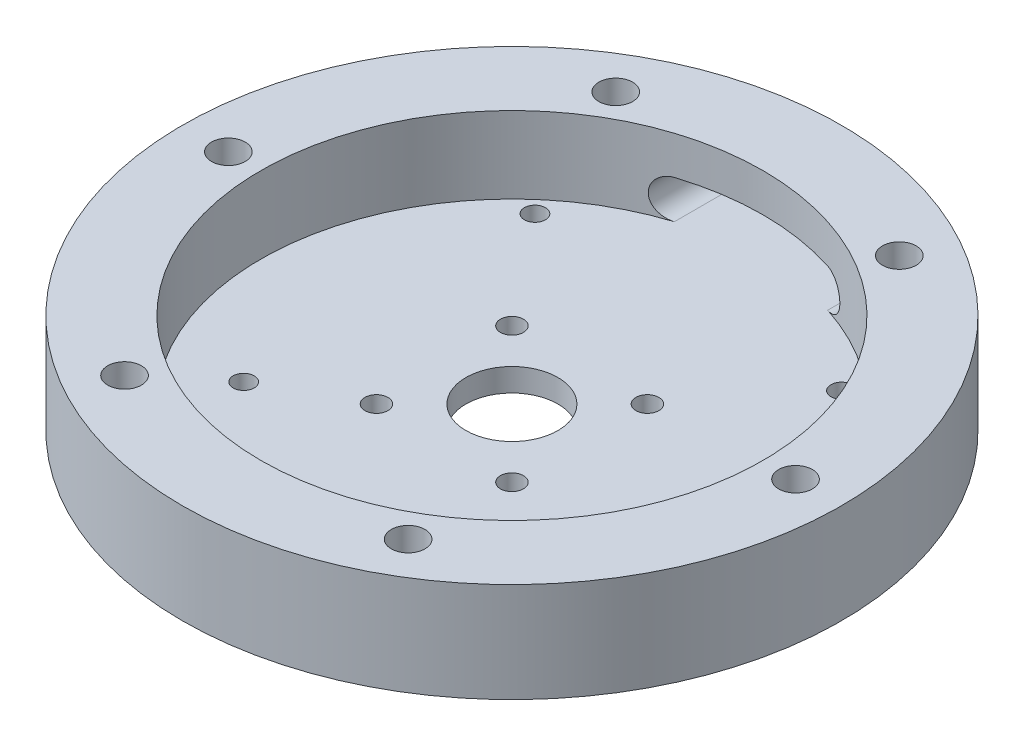
from build123d import *

# Parameters (mm, degrees)
SKETCH_1_R          = 43
SKETCH_1_R_2        = 6
EXTRUDE_1_DEPTH     = 3
SKETCH_14_R         = 43
SKETCH_14_R_2       = 32.76
EXTRUDE_5_DEPTH     = 10
SKETCH_17_R         = 2.35
EXTRUDE_6_DEPTH     = 6.4
SKETCH_18_R         = 1.375
CUT_EXTRUDE_5_DEPTH = 64.83071361
SKETCH_23_R         = 2.2
CUT_EXTRUDE_6_DEPTH = 6.1
CUT_EXTRUDE1_DEPTH  = 20
SKETCH_26_R         = 1.5
CUT_EXTRUDE3_DEPTH  = 6.1
CIRPATTERN1_COUNT   = 4
CIRPATTERN2_COUNT   = 6


with BuildPart() as part:
    # 스케치1 → 보스-돌출1 (new body)
    with BuildSketch(Plane(origin=(0, 0, 0), x_dir=(1, 0, 0), z_dir=(0, 1, 0))):
        with Locations(Location((0, 0, 0), (0, 0, 270))):
            Circle(SKETCH_1_R)
        with Locations(Location((0, 0, 0), (0, 0, 270))):
            Circle(SKETCH_1_R_2, mode=Mode.SUBTRACT)
    extrude(amount=EXTRUDE_1_DEPTH)

    # 스케치14 → 보스-돌출5 (add)
    with BuildSketch(Plane(origin=(0, 3, 0), x_dir=(1, 0, 0), z_dir=(0, 1, 0))):
        with Locations(Location((0, 0, 0), (0, 0, 270))):
            Circle(SKETCH_14_R)
        with Locations(Location((0, 0, 0), (0, 0, 270))):
            Circle(SKETCH_14_R_2, mode=Mode.SUBTRACT)
    extrude(amount=EXTRUDE_5_DEPTH)

    # 스케치17 → 보스-돌출6 (add)
    with BuildSketch(Plane.XZ):
        with Locations(Location((20, 15, 0), (0, 0, 90))):
            Circle(SKETCH_17_R)
        with Locations(Location((-20, 15, 0), (0, 0, 90))):
            Circle(SKETCH_17_R)
        with Locations(Location((20, -23, 0), (0, 0, 90))):
            Circle(SKETCH_17_R)
        with Locations(Location((-20, -23, 0), (0, 0, 90))):
            Circle(SKETCH_17_R)
    extrude(amount=EXTRUDE_6_DEPTH)

    # 스케치18 → 컷-돌출5 (cut, through all)
    with BuildSketch(Plane.XZ.offset(6.4)):
        with Locations(Location((-20, 15, 0), (0, 0, 270))):
            Circle(SKETCH_18_R)
        with Locations(Location((20, 15, 0), (0, 0, 270))):
            Circle(SKETCH_18_R)
        with Locations(Location((20, -23, 0), (0, 0, 270))):
            Circle(SKETCH_18_R)
        with Locations(Location((-20, -23, 0), (0, 0, 270))):
            Circle(SKETCH_18_R)
    extrude(amount=-CUT_EXTRUDE_5_DEPTH, mode=Mode.SUBTRACT)

    # 스케치23 → 컷-돌출6 (cut)
    with BuildSketch(Plane(origin=(0, 13, 0), x_dir=(1, 0, 0), z_dir=(0, 1, 0))):
        with Locations(Location((18.5, 32.04293994, 0), (0, 0, 270))):
            Circle(SKETCH_23_R)
    cut_extrude_6 = extrude(amount=-CUT_EXTRUDE_6_DEPTH, mode=Mode.SUBTRACT)

    # Sketch2 → Cut-Extrude1 (cut)
    with BuildSketch(Plane(origin=(0, 0, -43), x_dir=(-1, 0, 0), z_dir=(0, 0, -1))):
        with BuildLine():
            Line((-10, 8), (10, 8))
            ThreePointArc((10, 8), (12.5, 5.5), (10, 3))
            Line((10, 3), (-10, 3))
            ThreePointArc((-10, 3), (-12.5, 5.5), (-10, 8))
        make_face()
    extrude(amount=-CUT_EXTRUDE1_DEPTH, mode=Mode.SUBTRACT)

    # 스케치26 → Cut-Extrude3 (cut)
    with BuildSketch(Plane(origin=(0, 3, 0), x_dir=(1, 0, 0), z_dir=(0, 1, 0))):
        with Locations(Location((8.838834765, 8.838834765, 0), (0, 0, 270))):
            Circle(SKETCH_26_R)
    cut_extrude3 = extrude(amount=-CUT_EXTRUDE3_DEPTH, mode=Mode.SUBTRACT)

    # CirPattern1: Cut-Extrude3 ×4 about axis
    cirpattern1_axis = Axis((0, 0, 0), (0, 1, 0))
    for i in range(1, CIRPATTERN1_COUNT):
        add(cut_extrude3.rotate(cirpattern1_axis, i * 360 / CIRPATTERN1_COUNT), mode=Mode.SUBTRACT)

    # CirPattern2: 컷-돌출6 ×6 about axis
    cirpattern2_axis = Axis((0, 0, 0), (0, 1, 0))
    for i in range(1, CIRPATTERN2_COUNT):
        add(cut_extrude_6.rotate(cirpattern2_axis, i * 360 / CIRPATTERN2_COUNT), mode=Mode.SUBTRACT)


solid = part.part
